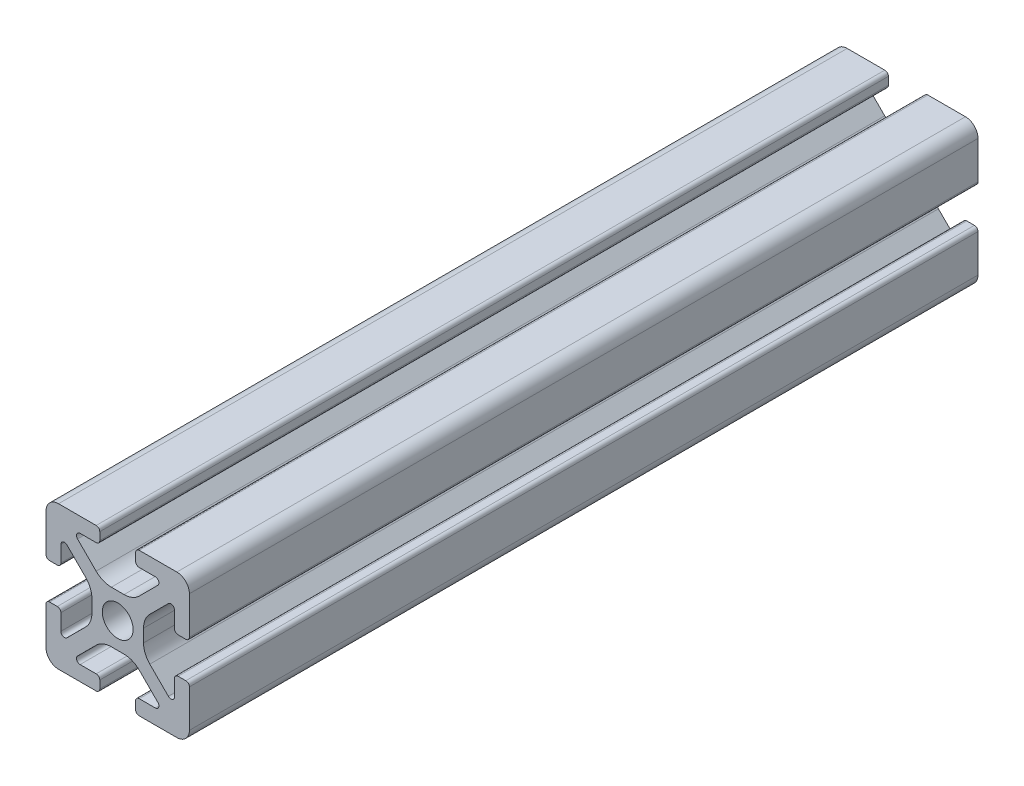
from build123d import *

# Parameters (mm, degrees)
BOSS_EXTRUDE1_DEPTH = 55


with BuildPart() as part:
    # Sketch4 → Boss-Extrude1 (new, symmetric)
    with BuildSketch(Plane.XY):
        with BuildLine():
            Line((3, -10), (8.25, -10))
            ThreePointArc((8.25, -10), (9.487436867, -9.487436867), (10, -8.25))
            Line((10, -8.25), (10, -3))
            ThreePointArc((10, -3), (9.853553391, -2.646446609), (9.5, -2.5))
            Line((9.5, -2.5), (8.424621202, -2.5))
            ThreePointArc((8.424621202, -2.5), (8.071067812, -2.646446609), (7.924621202, -3))
            Line((7.924621202, -3), (7.924621202, -5.25))
            ThreePointArc((7.924621202, -5.25), (7.615962919, -5.711939766), (7.071067812, -5.603553391))
            Line((7.071067812, -5.603553391), (4.478679656, -3.011165235))
            ThreePointArc((4.478679656, -3.011165235), (3.828361402, -2.037895189), (3.6, -0.889844892))
            Line((3.6, -0.889844892), (3.6, 0))
            Line((3.6, 0), (2.15, 0))
            ThreePointArc((2.15, 0), (1.52027958, -1.52027958), (0, -2.15))
            Line((0, -2.15), (0, -3.6))
            Line((0, -3.6), (0.889844892, -3.6))
            ThreePointArc((0.889844892, -3.6), (2.037895189, -3.828361402), (3.011165235, -4.478679656))
            Line((3.011165235, -4.478679656), (5.603553391, -7.071067812))
            ThreePointArc((5.603553391, -7.071067812), (5.711939766, -7.615962919), (5.25, -7.924621202))
            Line((5.25, -7.924621202), (3, -7.924621202))
            ThreePointArc((3, -7.924621202), (2.646446609, -8.071067812), (2.5, -8.424621202))
            Line((2.5, -8.424621202), (2.5, -9.5))
            ThreePointArc((2.5, -9.5), (2.646446609, -9.853553391), (3, -10))
        make_face()
    extrude(amount=BOSS_EXTRUDE1_DEPTH, both=True)

    # Mirror1: part across plane


with BuildPart() as part_1:
    add(part.part)
    add(part.part.mirror(Plane(origin=(0, 0, 0), x_dir=(0, 0, 1), z_dir=(1, 0, 0))))

    # Mirror2: part across plane


with BuildPart() as part_2:
    add(part_1.part)
    add(part_1.part.mirror(Plane.ZX))


solid = part_2.part
